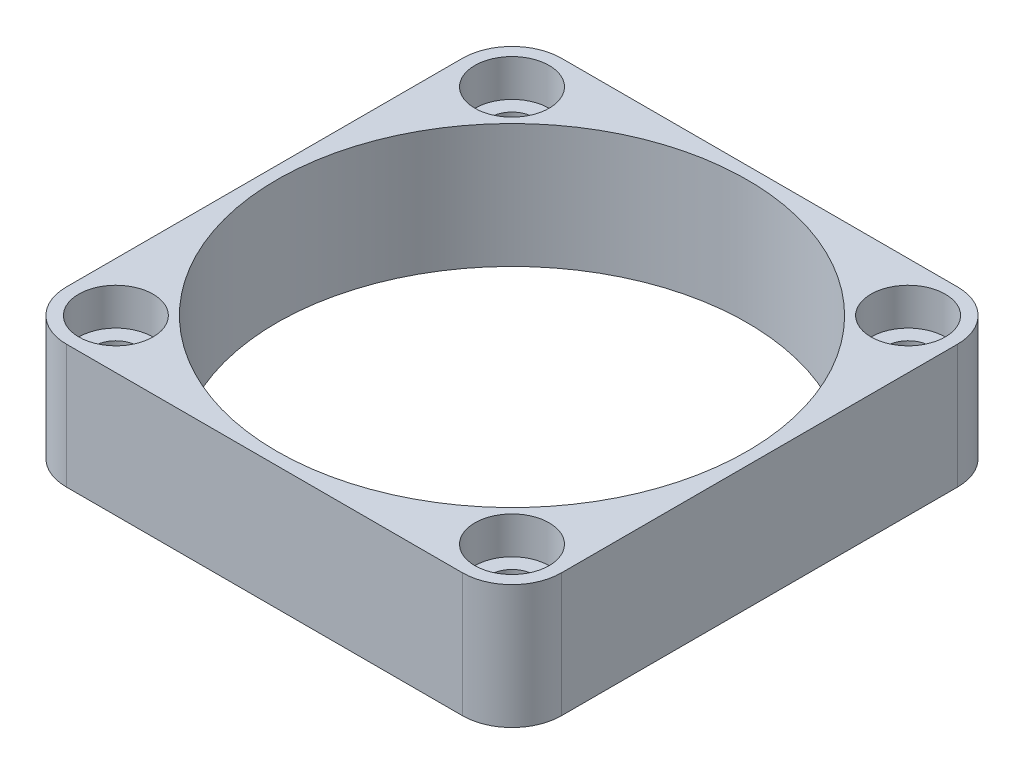
from build123d import *

# Parameters (mm, degrees)
BOSS_EXTRUDE1_DEPTH = 10
SKETCH2_R           = 3
CUT_EXTRUDE1_DEPTH  = 3
SKETCH2_5_R         = 1.75
CUT_EXTRUDE2_DEPTH  = 58.445626465
SKETCH5_R           = 19
CUT_EXTRUDE3_DEPTH  = 58.445626465


with BuildPart() as part:
    # Sketch1 → Boss-Extrude1 (new body)
    with BuildSketch(Plane(origin=(0, 0, 0), x_dir=(1, 0, 0), z_dir=(0, 1, 0))):
        with BuildLine():
            Line((4, 0), (36, 0))
            ThreePointArc((36, 0), (38.828427125, 1.171572875), (40, 4))
            Line((40, 4), (40, 36))
            ThreePointArc((40, 36), (38.828427125, 38.828427125), (36, 40))
            Line((36, 40), (4, 40))
            ThreePointArc((4, 40), (1.171572875, 38.828427125), (0, 36))
            Line((0, 36), (0, 4))
            ThreePointArc((0, 4), (1.171572875, 1.171572875), (4, 0))
        make_face()
    extrude(amount=BOSS_EXTRUDE1_DEPTH)

    # Sketch2 → Cut-Extrude1 (cut)
    with BuildSketch(Plane(origin=(0, 10, 0), x_dir=(1, 0, 0), z_dir=(0, 1, 0))):
        with Locations((4, 4)):
            Circle(SKETCH2_R)
        with Locations((4, 36)):
            Circle(SKETCH2_R)
        with Locations((36, 4)):
            Circle(SKETCH2_R)
        with Locations((36, 36)):
            Circle(SKETCH2_R)
    extrude(amount=-CUT_EXTRUDE1_DEPTH, mode=Mode.SUBTRACT)

    # Sketch2<5> → Cut-Extrude2 (cut, through all)
    with BuildSketch(Plane(origin=(0, 10, 0), x_dir=(1, 0, 0), z_dir=(0, 1, 0))):
        with Locations((4, 4)):
            Circle(SKETCH2_5_R)
        with Locations((4, 36)):
            Circle(SKETCH2_5_R)
        with Locations((36, 4)):
            Circle(SKETCH2_5_R)
        with Locations((36, 36)):
            Circle(SKETCH2_5_R)
    extrude(amount=-CUT_EXTRUDE2_DEPTH, mode=Mode.SUBTRACT)

    # Sketch5 → Cut-Extrude3 (cut, through all)
    with BuildSketch(Plane(origin=(0, 10, 0), x_dir=(1, 0, 0), z_dir=(0, 1, 0))):
        with Locations((20, 20)):
            Circle(SKETCH5_R)
    extrude(amount=-CUT_EXTRUDE3_DEPTH, mode=Mode.SUBTRACT)


solid = part.part
